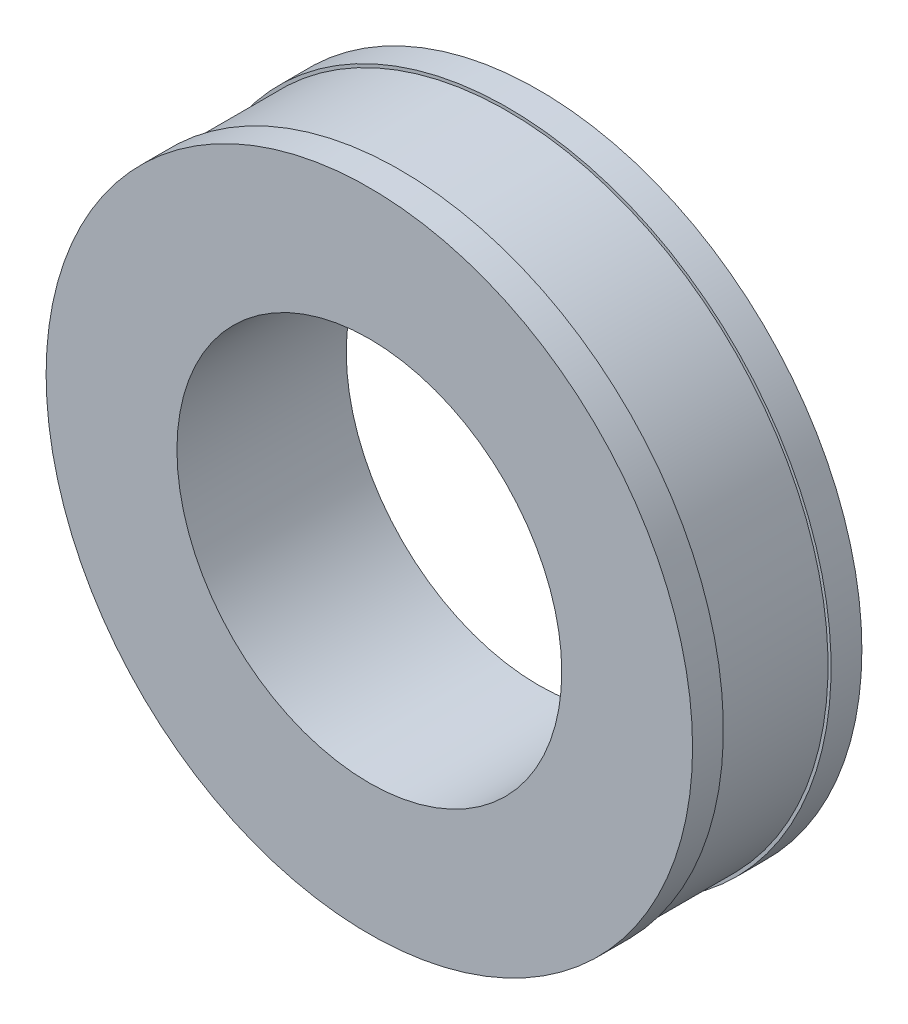
from build123d import *

# Parameters (mm, degrees)
ESQUISSE1_R        = 21
ESQUISSE1_R_2      = 12.5
BOSS_EXTRU_1_DEPTH = 11
ESQUISSE2_W        = 0.2
ESQUISSE2_H        = 7


with BuildPart() as part:
    # Esquisse1 → Boss.-Extru.1 (new body)
    with BuildSketch(Plane.XY):
        Circle(ESQUISSE1_R)
        Circle(ESQUISSE1_R_2, mode=Mode.SUBTRACT)
    extrude(amount=BOSS_EXTRU_1_DEPTH)

    # Esquisse2 → Enlèvement de matière-Révolution1 (revolve, cut)
    with BuildSketch(Plane(origin=(0, 0, 0), x_dir=(1, 0, 0), z_dir=(0, 1, 0))):
        with Locations((-20.9, -5.5)):
            Rectangle(ESQUISSE2_W, ESQUISSE2_H)
    revolve(axis=Axis((0, 0, 0), (0, 0, 1)), mode=Mode.SUBTRACT)


solid = part.part
